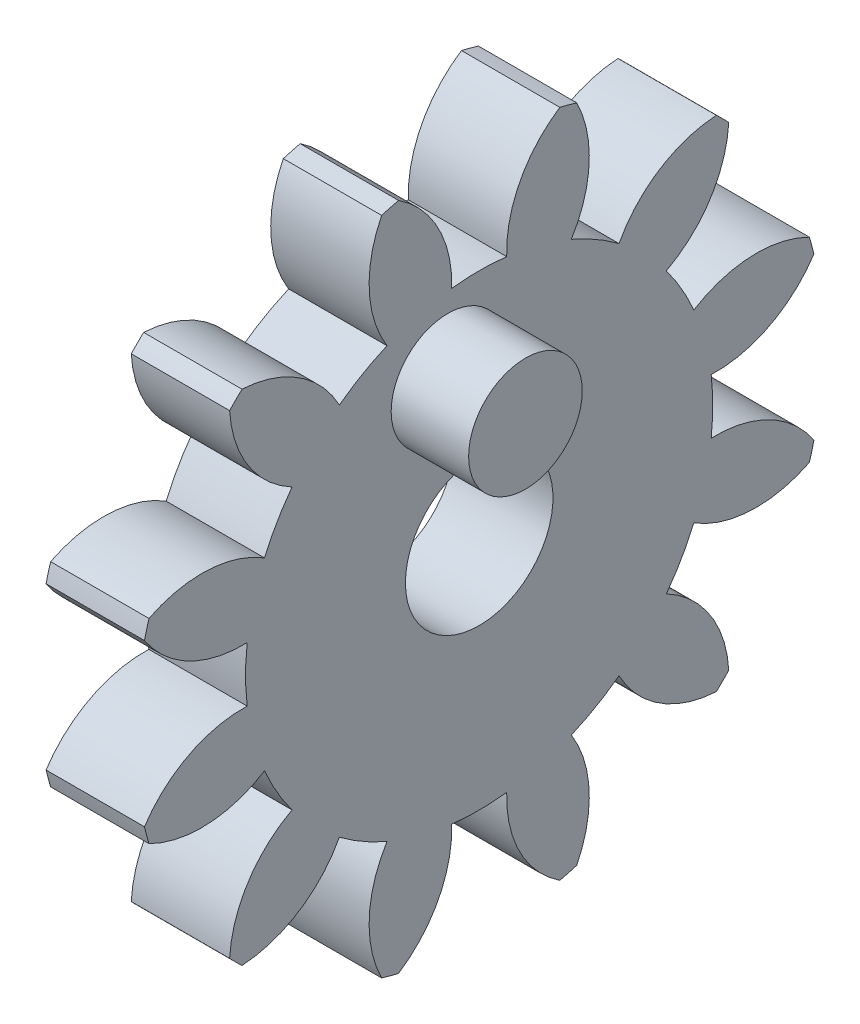
from build123d import *

# Parameters (mm, degrees)
BASPROSKE_W         = 12.7
BASPROSKE_H         = 44.45
TOOTHCUT_DEPTH      = 65.131856359
TEETHCUTS_COUNT     = 12
TEETHCUTS_ANGLE     = 330
BORSKE_R            = 9.525
BORE_DEPTH          = 25.4000508
SKETCH1_R           = 7.333370579
BOSS_EXTRUDE1_DEPTH = 10


with BuildPart() as part:
    # BasProSke → Base-Revolve (revolve)
    with BuildSketch(Plane(origin=(0, 0, 0), x_dir=(1, 0, 0), z_dir=(0, 1, 0)), mode=Mode.PRIVATE) as base_revolve_sk:
        with Locations((6.35, 22.225)):
            Rectangle(BASPROSKE_W, BASPROSKE_H)
    revolve(base_revolve_sk.sketch.rotate(Axis((-10, 0, 0), (1, 0, 0)), 180), axis=Axis((-10, 0, 0), (1, 0, 0)))

    # TooCutSke → ToothCut (cut, through all)
    with BuildSketch(Plane(origin=(0, 0, 0), x_dir=(0, 0, -1), z_dir=(1, 0, 0))):
        with BuildLine():
            ThreePointArc((3.552242783, 29.951316604), (0, 30.16123), (-3.552242783, 29.951316604))
            ThreePointArc((-3.552242783, 29.951316604), (-5.254049238, 37.49538421), (-10.439744342, 43.232776261))
            ThreePointArc((-10.439744342, 43.232776261), (0, 44.4754), (10.439744342, 43.232776261))
            ThreePointArc((10.439744342, 43.232776261), (5.254049238, 37.49538421), (3.552242783, 29.951316604))
        make_face()
    toothcut = extrude(amount=TOOTHCUT_DEPTH, mode=Mode.SUBTRACT)

    # TeethCuts: ToothCut ×12 about axis
    teethcuts_axis = Axis((-10, 0, 0), (1, 0, 0))
    for i in range(1, TEETHCUTS_COUNT):
        add(toothcut.rotate(teethcuts_axis, i * TEETHCUTS_ANGLE / (TEETHCUTS_COUNT - 1)), mode=Mode.SUBTRACT)

    # BorSke → Bore (cut, symmetric)
    with BuildSketch(Plane(origin=(0, 0, 0), x_dir=(0, 0, -1), z_dir=(1, 0, 0))):
        with Locations(Location((0, 0, 0), (0, 0, 180))):
            Circle(BORSKE_R)
    extrude(amount=BORE_DEPTH, both=True, mode=Mode.SUBTRACT)

    # Sketch1 → Boss-Extrude1 (add)
    with BuildSketch(Plane(origin=(12.7, 0, 0), x_dir=(0, 0, -1), z_dir=(1, 0, 0))):
        with Locations(Location((-4.029324494, 20.06603598, 0), (0, 0, 180))):
            Circle(SKETCH1_R)
    extrude(amount=BOSS_EXTRUDE1_DEPTH)


solid = part.part
